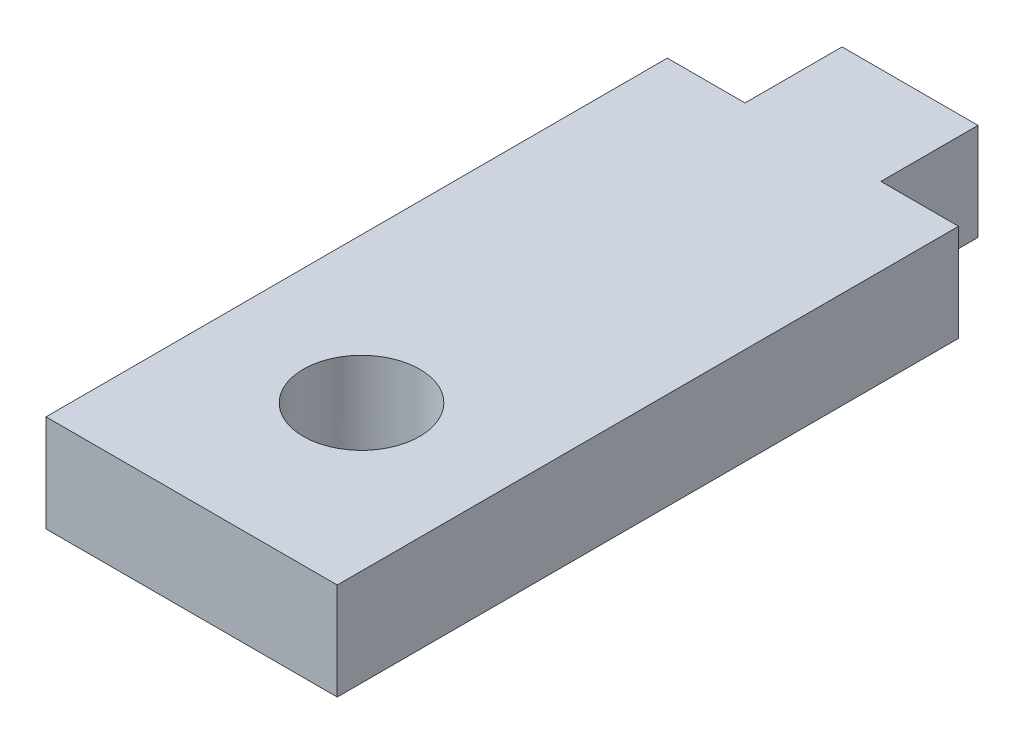
from build123d import *

# Parameters (mm, degrees)
BOSS_EXTRUDE1_DEPTH = 5
SKETCH2_R           = 3
CUT_EXTRUDE1_DEPTH  = 10


with BuildPart() as part:
    # Sketch1 → Boss-Extrude1 (new body)
    with BuildSketch(Plane(origin=(0, 0, 0), x_dir=(1, 0, 0), z_dir=(0, 1, 0))):
        Polygon((-7.5, -16), (-7.5, 16), (-3.5, 16), (-3.5, 21), (3.5, 21), (3.5, 16), (7.5, 16), (7.5, -16), align=None)
    extrude(amount=BOSS_EXTRUDE1_DEPTH)

    # Sketch2 → Cut-Extrude1 (cut)
    with BuildSketch(Plane(origin=(0, 5, 0), x_dir=(1, 0, 0), z_dir=(0, 1, 0))):
        with Locations(Location((0, -7.25, 0), (0, 0, 270))):
            Circle(SKETCH2_R)
    extrude(amount=-CUT_EXTRUDE1_DEPTH, mode=Mode.SUBTRACT)


solid = part.part
